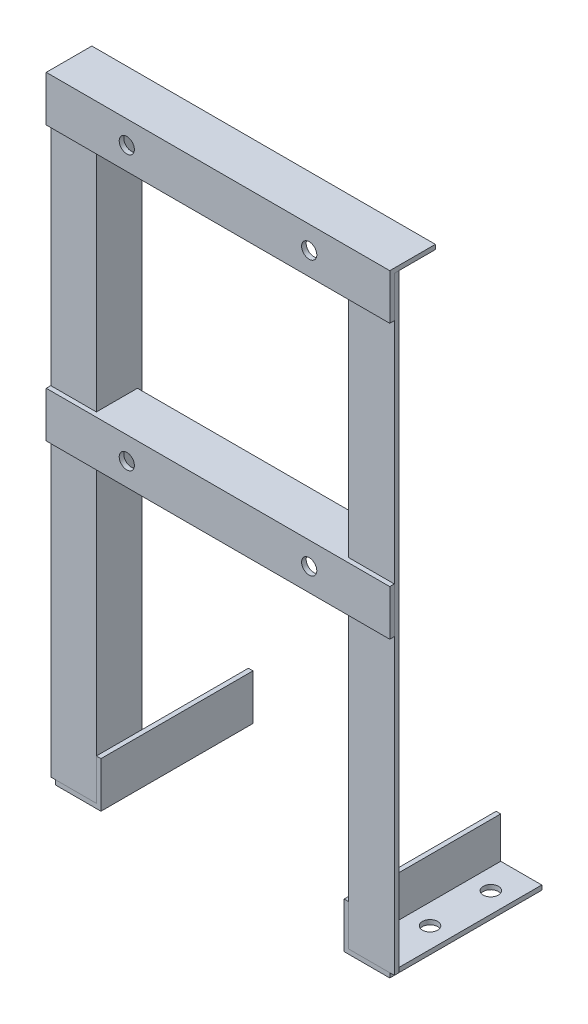
from build123d import *

# Parameters (mm, degrees)
BOSS_EXTRUDE1_DEPTH   = 100
BOSS_EXTRUDE1_2_DEPTH = 100
BOSS_EXTRUDE2_START   = 3
BOSS_EXTRUDE2_DEPTH   = 400
BOSS_EXTRUDE2_2_DEPTH = 400
BOSS_EXTRUDE3_DEPTH   = 113
SKETCH4_W             = 3
SKETCH4_H             = 30
BOSS_EXTRUDE4_DEPTH   = 113
SKETCH5_W             = 30
SKETCH5_H             = 3
BOSS_EXTRUDE5_DEPTH   = 83
SKETCH6_R             = 5
CUT_EXTRUDE1_DEPTH    = 434.836374685
SKETCH7_R             = 5
CUT_EXTRUDE2_DEPTH    = 3


with BuildPart() as part:
    # Sketch1 → Boss-Extrude1 (new body)
    with BuildSketch(Plane.XY):
        Polygon((-80, 30), (-80, 0), (-110, 0), (-110, 3), (-83, 3), (-83, 30), align=None)
    extrude(amount=-BOSS_EXTRUDE1_DEPTH)


with BuildPart() as body_2:
    # Sketch1 → Boss-Extrude1 2 (new body)
    with BuildSketch(Plane.XY):
        Polygon((83, 30), (80, 30), (80, 0), (110, 0), (110, 3), (83, 3), align=None)
    extrude(amount=-BOSS_EXTRUDE1_2_DEPTH)


with BuildPart() as body_3:
    # Sketch2 → Boss-Extrude2 (new body)
    with BuildSketch(Plane(origin=(0, 0, 0), x_dir=(1, 0, 0), z_dir=(0, 1, 0)).offset(BOSS_EXTRUDE2_START)):
        Polygon((83, 30), (83, 0), (113, 0), (113, 3), (86, 3), (86, 30), align=None)
    extrude(amount=BOSS_EXTRUDE2_DEPTH)


with BuildPart() as body_4:
    # Sketch2 → Boss-Extrude2 2 (new body)
    with BuildSketch(Plane(origin=(0, 0, 0), x_dir=(1, 0, 0), z_dir=(0, 1, 0)).offset(BOSS_EXTRUDE2_START)):
        Polygon((-86, 30), (-83, 30), (-83, 0), (-113, 0), (-113, 3), (-86, 3), align=None)
    extrude(amount=BOSS_EXTRUDE2_2_DEPTH)


with BuildPart() as body_5:
    # Sketch3 → Boss-Extrude3 (new, symmetric)
    with BuildSketch(Plane(origin=(0, 0, 0), x_dir=(0, 0, -1), z_dir=(1, 0, 0))):
        Polygon((27, 406), (-3, 406), (-3, 376), (0, 376), (0, 403), (27, 403), align=None)
    extrude(amount=BOSS_EXTRUDE3_DEPTH, both=True)


with BuildPart() as body_6:
    # Sketch4 → Boss-Extrude4 (new, symmetric)
    with BuildSketch(Plane(origin=(0, 0, 0), x_dir=(0, 0, -1), z_dir=(1, 0, 0))):
        with Locations((-1.5, 211)):
            Rectangle(SKETCH4_W, SKETCH4_H)
    extrude(amount=BOSS_EXTRUDE4_DEPTH, both=True)

    # Sketch5 → Boss-Extrude5 (add, symmetric)
    with BuildSketch(Plane(origin=(0, 0, 0), x_dir=(0, 0, -1), z_dir=(1, 0, 0))):
        with Locations((12, 224.5)):
            Rectangle(SKETCH5_W, SKETCH5_H)
    extrude(amount=BOSS_EXTRUDE5_DEPTH, both=True)


with BuildPart() as cut_extrude1_tool:
    # Sketch6 → Cut-Extrude1 (new, through all)
    with BuildSketch(Plane.XY.offset(3)):
        with Locations((-60, 391)):
            Circle(SKETCH6_R)
        with Locations((60, 391)):
            Circle(SKETCH6_R)
        with Locations((-60, 211)):
            Circle(SKETCH6_R)
        with Locations((60, 211)):
            Circle(SKETCH6_R)
    extrude(amount=-CUT_EXTRUDE1_DEPTH)


with BuildPart() as body_5_1:
    add(body_5.part)

    # Cut-Extrude1: cut by cut_extrude1_tool
    add(cut_extrude1_tool.part, mode=Mode.SUBTRACT)


with BuildPart() as body_6_1:
    add(body_6.part)

    # Cut-Extrude1: cut by cut_extrude1_tool
    add(cut_extrude1_tool.part, mode=Mode.SUBTRACT)


with BuildPart() as cut_extrude2_tool:
    # Sketch7 → Cut-Extrude2 (new body)
    with BuildSketch(Plane(origin=(0, 0, 0), x_dir=(1, 0, 0), z_dir=(0, 1, 0))):
        with Locations(Location((-96.5, 80, 0), (0, 0, 90))):
            Circle(SKETCH7_R)
        with Locations(Location((-96.5, 40, 0), (0, 0, 90))):
            Circle(SKETCH7_R)
        with Locations(Location((96.5, 80, 0), (0, 0, 90))):
            Circle(SKETCH7_R)
        with Locations(Location((96.5, 40, 0), (0, 0, 90))):
            Circle(SKETCH7_R)
    extrude(amount=CUT_EXTRUDE2_DEPTH)


with BuildPart() as part_1:
    add(part.part)

    # Cut-Extrude2: cut by cut_extrude2_tool
    add(cut_extrude2_tool.part, mode=Mode.SUBTRACT)


with BuildPart() as body_2_1:
    add(body_2.part)

    # Cut-Extrude2: cut by cut_extrude2_tool
    add(cut_extrude2_tool.part, mode=Mode.SUBTRACT)


solid = Compound([body_3.part, body_4.part, body_5_1.part, body_6_1.part, part_1.part, body_2_1.part])
